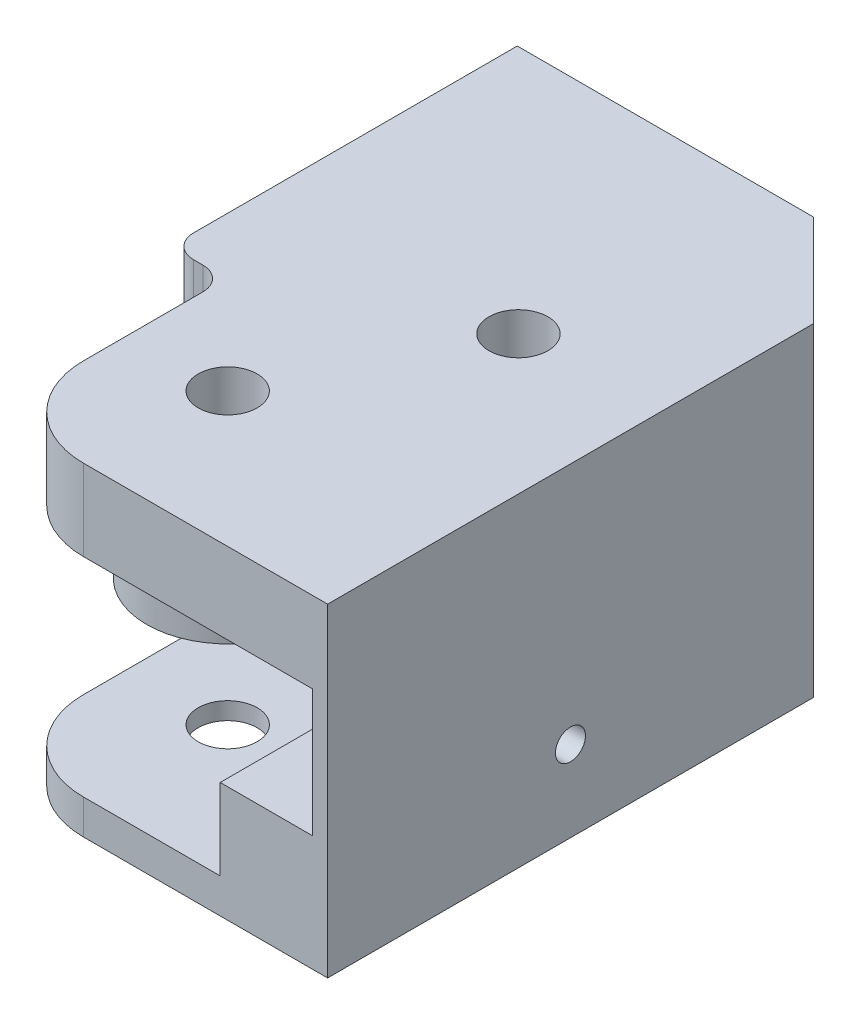
from build123d import *

# Parameters (mm, degrees)
SKETCH_1_R          = 2.55
EXTRUDE_1_DEPTH     = 3
SKETCH_3_R          = 2.55
EXTRUDE_2_DEPTH     = 7
EXTRUDE_3_DEPTH     = 11
SKETCH_5_R          = 2.55
EXTRUDE_4_DEPTH     = 7
EXTRUDE_START       = 7
SKETCH_6_R          = 7
SKETCH_6_R_2        = 2.55
EXTRUDE_5_DEPTH     = 7
SKETCH_7_R          = 1.3
CUT_EXTRUDE_1_DEPTH = 5
SKETCH_8_R          = 1.3
CUT_EXTRUDE_2_DEPTH = 5
SKETCH_9_R          = 5
CUT_EXTRUDE_3_DEPTH = 1.5
CUT_EXTRUDE_4_REACH = 38.718
FILLET_1_R          = 2


with BuildPart() as part:
    # Эскиз1 → Бобышка-Вытянуть1 (new body)
    with BuildSketch(Plane(origin=(0, 0, 0), x_dir=(1, 0, 0), z_dir=(0, 1, 0))):
        with BuildLine():
            Line((8.8, 25), (-16.8, 25))
            Line((-16.8, 25), (-16.8, -3))
            ThreePointArc((-16.8, -3), (-16.214213562, -4.414213562), (-14.8, -5))
            Line((-14.8, -5), (-13.979301231, -5))
            ThreePointArc((-13.979301231, -5), (-12.565087669, -5.585786438), (-11.979301231, -7))
            Line((-11.979301231, -7), (-11.979301231, -17.343145751))
            ThreePointArc((-11.979301231, -17.343145751), (-9.736660544, -22.757359313), (-4.322446982, -25))
            Line((-4.322446982, -25), (16.8, -25))
            Line((16.8, -25), (16.8, 17))
            Line((16.8, 17), (8.8, 25))
        make_face()
        with Locations(Location((4.8, 3.5, 0), (0, 0, 270))):
            Circle(SKETCH_1_R, mode=Mode.SUBTRACT)
        with Locations(Location((-3.489533647, -13.352791034, 0), (0, 0, 270))):
            Circle(SKETCH_1_R, mode=Mode.SUBTRACT)
    extrude(amount=EXTRUDE_1_DEPTH)

    # Эскиз3 → Бобышка-Вытянуть2 (add)
    with BuildSketch(Plane(origin=(0, 3, 0), x_dir=(1, 0, 0), z_dir=(0, 1, 0))):
        with BuildLine():
            Line((8.8, 25), (-16.8, 25))
            Line((-16.8, 25), (-16.8, -2.352791034))
            Line((-16.8, -2.352791034), (-3.489533647, -2.352791034))
            ThreePointArc((-3.489533647, -2.352791034), (4.288640946, -5.574616441), (7.510466353, -13.352791034))
            Line((7.510466353, -13.352791034), (7.510466353, -25))
            Line((7.510466353, -25), (16.8, -25))
            Line((16.8, -25), (16.8, 17))
            Line((16.8, 17), (8.8, 25))
        make_face()
        with Locations(Location((4.8, 3.5, 0), (0, 0, 270))):
            Circle(SKETCH_3_R, mode=Mode.SUBTRACT)
    extrude(amount=EXTRUDE_2_DEPTH)

    # Эскиз4 → Бобышка-Вытянуть3 (add)
    with BuildSketch(Plane(origin=(0, 10, 0), x_dir=(1, 0, 0), z_dir=(0, 1, 0))):
        with BuildLine():
            Line((8.8, 25), (-16.8, 25))
            Line((-16.8, 25), (-16.8, 14.51476677))
            Line((-16.8, 14.51476677), (5.031765415, 14.51476677))
            ThreePointArc((5.031765415, 14.51476677), (13.930610034, 9.983309776), (15.5, 0.121233261))
            Line((15.5, 0.121233261), (15.5, -25))
            Line((15.5, -25), (16.8, -25))
            Line((16.8, -25), (16.8, 17))
            Line((16.8, 17), (8.8, 25))
        make_face()
    extrude(amount=EXTRUDE_3_DEPTH)

    # Эскиз5 → Бобышка-Вытянуть4 (add)
    with BuildSketch(Plane(origin=(0, 21, 0), x_dir=(1, 0, 0), z_dir=(0, 1, 0))):
        with BuildLine():
            Line((8.8, 25), (-16.8, 25))
            Line((-16.8, 25), (-16.8, -3))
            ThreePointArc((-16.8, -3), (-16.214213562, -4.414213562), (-14.8, -5))
            Line((-14.8, -5), (-13.979301231, -5))
            ThreePointArc((-13.979301231, -5), (-12.565087669, -5.585786438), (-11.979301231, -7))
            Line((-11.979301231, -7), (-11.979301231, -23))
            ThreePointArc((-11.979301231, -23), (-11.393514794, -24.414213562), (-9.979301231, -25))
            Line((-9.979301231, -25), (16.8, -25))
            Line((16.8, -25), (16.8, 17))
            Line((16.8, 17), (8.8, 25))
        make_face()
        with Locations(Location((4.8, 3.5, 0), (0, 0, 270))):
            Circle(SKETCH_5_R, mode=Mode.SUBTRACT)
        with Locations(Location((-3.489533647, -13.352791034, 0), (0, 0, 270))):
            Circle(SKETCH_5_R, mode=Mode.SUBTRACT)
    extrude(amount=EXTRUDE_4_DEPTH)

    # Эскиз6 → Бобышка-Вытянуть5 (add)
    with BuildSketch(Plane.XZ.offset(-21).offset(EXTRUDE_START)):
        with Locations(Location((-3.489533647, 13.352791034, 0), (0, 0, 90))):
            Circle(SKETCH_6_R)
        with Locations(Location((-3.489533647, 13.352791034, 0), (0, 0, 90))):
            Circle(SKETCH_6_R_2, mode=Mode.SUBTRACT)
    extrude(amount=-EXTRUDE_5_DEPTH)

    # Эскиз7 → Вырез-Вытянуть1 (cut)
    with BuildSketch(Plane(origin=(0, 0, -25), x_dir=(-1, 0, 0), z_dir=(0, 0, -1))):
        with Locations((4, 13.75)):
            Circle(SKETCH_7_R)
    extrude(amount=-CUT_EXTRUDE_1_DEPTH, mode=Mode.SUBTRACT)

    # Эскиз8 → Вырез-Вытянуть2 (cut)
    with BuildSketch(Plane(origin=(16.8, 0, 0), x_dir=(0, 0, -1), z_dir=(1, 0, 0))):
        with Locations((-4, 7)):
            Circle(SKETCH_8_R)
    extrude(amount=-CUT_EXTRUDE_2_DEPTH, mode=Mode.SUBTRACT)

    # Эскиз9 → Вырез-Вытянуть3 (cut)
    with BuildSketch(Plane.XZ):
        with Locations(Location((-3.489533647, 13.352791034, 0), (0, 0, 270))):
            Circle(SKETCH_9_R)
        with Locations(Location((4.8, -3.5, 0), (0, 0, 270))):
            Circle(SKETCH_9_R)
    extrude(amount=-CUT_EXTRUDE_3_DEPTH, mode=Mode.SUBTRACT)

    # Эскиз10 → Вырез-Вытянуть4 (cut, up to next)
    with BuildSketch(Plane.XZ.offset(-21), mode=Mode.PRIVATE) as cut_extrude_4_sk1:
        with BuildLine():
            Line((-4.322446982, 25), (-11.979301231, 25))
            Line((-11.979301231, 25), (-11.979301231, 17.343145751))
            ThreePointArc((-11.979301231, 17.343145751), (-9.736660544, 22.757359313), (-4.322446982, 25))
        make_face()
    cut_extrude_4_tool1 = extrude(cut_extrude_4_sk1.sketch, amount=-CUT_EXTRUDE_4_REACH, mode=Mode.PRIVATE) & part.part
    add(cut_extrude_4_tool1.solids().sort_by_distance((-10.269005, 21, 23.289704))[0], mode=Mode.SUBTRACT)

    # Скругление1
    fillet_1_edges = [part.edges().sort_by_distance(p)[0] for p in [
        (-3.489533647, 21, 6.352791034),
    ]]
    fillet(fillet_1_edges, radius=FILLET_1_R)


solid = part.part
